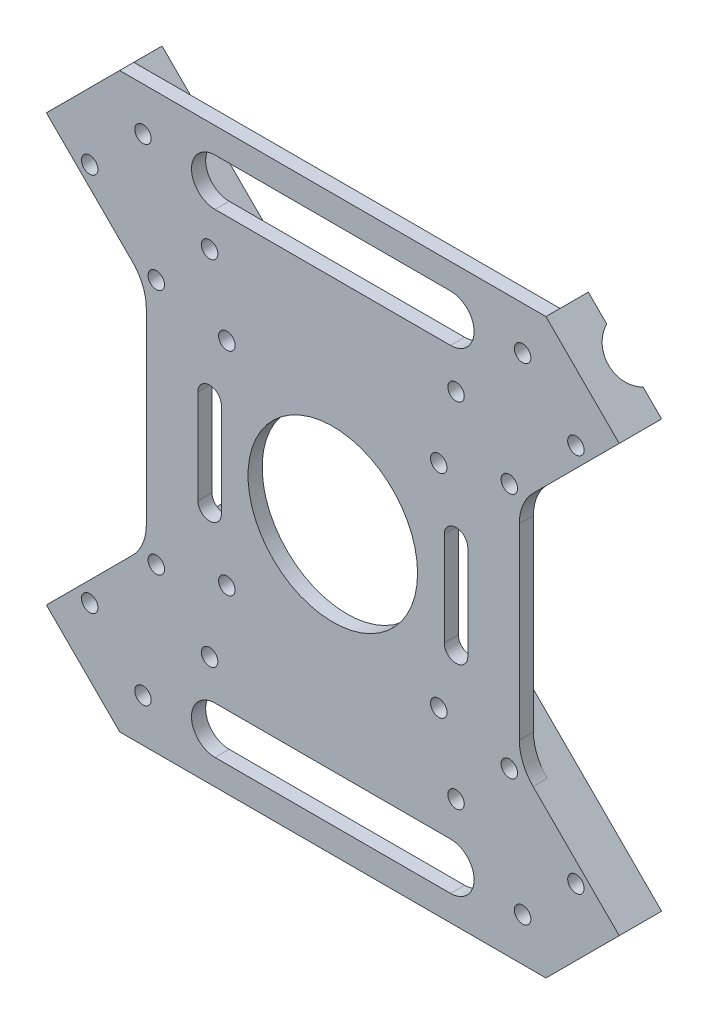
from build123d import *

# Parameters (mm, degrees)
SKETCH1_R           = 18
SKETCH1_R_2         = 1.75
BOSS_EXTRUDE1_DEPTH = 3
BOSS_EXTRUDE3_DEPTH = 6
CUT_EXTRUDE1_REACH  = 163.112
SKETCH4_R           = 6
CUT_EXTRUDE2_REACH  = 163.112
SKETCH5_R           = 6
CUT_EXTRUDE3_START  = -12
SKETCH1_7_R         = 1.75
CUT_EXTRUDE3_DEPTH  = 12
CUT_EXTRUDE4_START  = -12
SKETCH1_8_R         = 1.75
CUT_EXTRUDE4_DEPTH  = 12


with BuildPart() as part:
    # Sketch1 → Boss-Extrude1 (new body)
    with BuildSketch(Plane.XY):
        with BuildLine():
            Line((-45.254833996, 60.811183182), (45.254833996, 60.811183182))
            Line((45.254833996, 60.811183182), (60.811183182, 45.254833996))
            Line((60.811183182, 45.254833996), (42.526911935, 26.970562748))
            ThreePointArc((42.526911935, 26.970562748), (40.359184421, 23.72632926), (39.597979746, 19.899494937))
            Line((39.597979746, 19.899494937), (39.597979746, -19.899494937))
            ThreePointArc((39.597979746, -19.899494937), (40.359184421, -23.72632926), (42.526911935, -26.970562748))
            Line((42.526911935, -26.970562748), (60.811183182, -45.254833996))
            Line((60.811183182, -45.254833996), (45.254833996, -60.811183182))
            Line((45.254833996, -60.811183182), (-45.254833996, -60.811183182))
            Line((-45.254833996, -60.811183182), (-60.811183182, -45.254833996))
            Line((-60.811183182, -45.254833996), (-42.526911935, -26.970562748))
            ThreePointArc((-42.526911935, -26.970562748), (-40.359184421, -23.72632926), (-39.597979746, -19.899494937))
            Line((-39.597979746, -19.899494937), (-39.597979746, 19.899494937))
            ThreePointArc((-39.597979746, 19.899494937), (-40.359184421, 23.72632926), (-42.526911935, 26.970562748))
            Line((-42.526911935, 26.970562748), (-60.811183182, 45.254833996))
            Line((-60.811183182, 45.254833996), (-45.254833996, 60.811183182))
        make_face()
        Circle(SKETCH1_R, mode=Mode.SUBTRACT)
        with Locations((-37.476659403, -26.162950904)):
            Circle(SKETCH1_R_2, mode=Mode.SUBTRACT)
        with Locations((-26.162950904, -37.476659403)):
            Circle(SKETCH1_R_2, mode=Mode.SUBTRACT)
        with Locations((-40.305086528, -51.618795027)):
            Circle(SKETCH1_R_2, mode=Mode.SUBTRACT)
        with Locations((-51.618795027, -40.305086528)):
            Circle(SKETCH1_R_2, mode=Mode.SUBTRACT)
        with Locations((-22.5, 22.5)):
            Circle(SKETCH1_R_2, mode=Mode.SUBTRACT)
        with Locations((22.5, 22.5)):
            Circle(SKETCH1_R_2, mode=Mode.SUBTRACT)
        with Locations((26.162950904, 37.476659403)):
            Circle(SKETCH1_R_2, mode=Mode.SUBTRACT)
        with Locations((37.476659403, 26.162950904)):
            Circle(SKETCH1_R_2, mode=Mode.SUBTRACT)
        with Locations((51.618795027, 40.305086528)):
            Circle(SKETCH1_R_2, mode=Mode.SUBTRACT)
        with Locations((40.305086528, 51.618795027)):
            Circle(SKETCH1_R_2, mode=Mode.SUBTRACT)
        with Locations((22.5, -22.5)):
            Circle(SKETCH1_R_2, mode=Mode.SUBTRACT)
        with Locations((40.305086528, -51.618795027)):
            Circle(SKETCH1_R_2, mode=Mode.SUBTRACT)
        with Locations((51.618795027, -40.305086528)):
            Circle(SKETCH1_R_2, mode=Mode.SUBTRACT)
        with Locations((37.476659403, -26.162950904)):
            Circle(SKETCH1_R_2, mode=Mode.SUBTRACT)
        with Locations((26.162950904, -37.476659403)):
            Circle(SKETCH1_R_2, mode=Mode.SUBTRACT)
        with Locations((-22.5, -22.5)):
            Circle(SKETCH1_R_2, mode=Mode.SUBTRACT)
        with Locations((-51.618795027, 40.305086528)):
            Circle(SKETCH1_R_2, mode=Mode.SUBTRACT)
        with Locations((-40.305086528, 51.618795027)):
            Circle(SKETCH1_R_2, mode=Mode.SUBTRACT)
        with Locations((-26.162950904, 37.476659403)):
            Circle(SKETCH1_R_2, mode=Mode.SUBTRACT)
        with Locations((-37.476659403, 26.162950904)):
            Circle(SKETCH1_R_2, mode=Mode.SUBTRACT)
        with BuildLine():
            Line((-25, -55.386039841), (25, -55.386039841))
            ThreePointArc((25, -55.386039841), (30, -50.386039841), (25, -45.386039841))
            Line((25, -45.386039841), (-25, -45.386039841))
            ThreePointArc((-25, -45.386039841), (-30, -50.386039841), (-25, -55.386039841))
        make_face(mode=Mode.SUBTRACT)
        with BuildLine():
            Line((23.662950904, -10), (23.662950904, 10))
            ThreePointArc((23.662950904, 10), (26.162950904, 12.5), (28.662950904, 10))
            Line((28.662950904, 10), (28.662950904, -10))
            ThreePointArc((28.662950904, -10), (26.162950904, -12.5), (23.662950904, -10))
        make_face(mode=Mode.SUBTRACT)
        with BuildLine():
            Line((-28.662950904, -10), (-28.662950904, 10))
            ThreePointArc((-28.662950904, 10), (-26.162950904, 12.5), (-23.662950904, 10))
            Line((-23.662950904, 10), (-23.662950904, -10))
            ThreePointArc((-23.662950904, -10), (-26.162950904, -12.5), (-28.662950904, -10))
        make_face(mode=Mode.SUBTRACT)
        with BuildLine():
            Line((-25, 45.386039841), (25, 45.386039841))
            ThreePointArc((25, 45.386039841), (30, 50.386039841), (25, 55.386039841))
            Line((25, 55.386039841), (-25, 55.386039841))
            ThreePointArc((-25, 55.386039841), (-30, 50.386039841), (-25, 45.386039841))
        make_face(mode=Mode.SUBTRACT)
    extrude(amount=BOSS_EXTRUDE1_DEPTH)

    # Sketch3 → Boss-Extrude3 (add)
    with BuildSketch(Plane.XY):
        Polygon((-60.811183182, 45.254833996), (-45.254833996, 60.811183182), (-17.053249746, 32.609598932), (-32.609598932, 17.053249746), align=None)
        Polygon((-60.811183182, -45.254833996), (-32.609598932, -17.053249746), (-17.053249746, -32.609598932), (-45.254833996, -60.811183182), align=None)
        Polygon((60.811183182, -45.254833996), (45.254833996, -60.811183182), (17.053249746, -32.609598932), (32.609598932, -17.053249746), align=None)
        Polygon((60.811183182, 45.254833996), (32.609598932, 17.053249746), (17.053249746, 32.609598932), (45.254833996, 60.811183182), align=None)
    extrude(amount=-BOSS_EXTRUDE3_DEPTH)

    # Cut-Extrude1: up to this face of the body (flat: up to its plane)
    cut_extrude1_end = Plane(part.part.faces().sort_by_distance((53.033008589, -53.033008589, -1.5))[0])
    # Sketch4 → Cut-Extrude1 (cut, up to the picked face)
    with BuildSketch(Plane(origin=(-53.033008589, 53.033008589, 0), x_dir=(0, 0, 1), z_dir=(-0.7071067811865477, 0.7071067811865475, 0)), mode=Mode.PRIVATE) as cut_extrude1_sk1:
        with Locations((-8.5, 0)):
            Circle(SKETCH4_R)
    cut_extrude1_tool1 = split(extrude(cut_extrude1_sk1.sketch, amount=-CUT_EXTRUDE1_REACH, mode=Mode.PRIVATE), bisect_by=cut_extrude1_end, keep=Keep.BOTH, mode=Mode.PRIVATE)
    add(cut_extrude1_tool1.solids().sort_by(Axis((-53.033009, 53.033009, -8.5), (0.7071067811865477, -0.7071067811865475, 0)))[0], mode=Mode.SUBTRACT)

    # Cut-Extrude2: up to this face of the body (flat: up to its plane)
    cut_extrude2_end = Plane(part.part.faces().sort_by_distance((53.033008589, 53.033008589, -1.5))[0])
    # Sketch5 → Cut-Extrude2 (cut, up to the picked face)
    with BuildSketch(Plane(origin=(-53.033008589, -53.033008589, 0), x_dir=(0, 0, 1), z_dir=(-0.7071067811865477, -0.7071067811865475, 0)), mode=Mode.PRIVATE) as cut_extrude2_sk1:
        with Locations((-8.5, 0)):
            Circle(SKETCH5_R)
    cut_extrude2_tool1 = split(extrude(cut_extrude2_sk1.sketch, amount=-CUT_EXTRUDE2_REACH, mode=Mode.PRIVATE), bisect_by=cut_extrude2_end, keep=Keep.BOTH, mode=Mode.PRIVATE)
    add(cut_extrude2_tool1.solids().sort_by(Axis((-53.033009, -53.033009, -8.5), (0.7071067811865477, 0.7071067811865475, 0)))[0], mode=Mode.SUBTRACT)

    # Sketch1<7> → Cut-Extrude3 (cut)
    with BuildSketch(Plane.XY.offset(CUT_EXTRUDE3_START)):
        with Locations((-37.476659403, -26.162950904)):
            Circle(SKETCH1_7_R)
        with Locations((-26.162950904, -37.476659403)):
            Circle(SKETCH1_7_R)
        with Locations((-40.305086528, -51.618795027)):
            Circle(SKETCH1_7_R)
        with Locations((-51.618795027, -40.305086528)):
            Circle(SKETCH1_7_R)
        with Locations((26.162950904, 37.476659403)):
            Circle(SKETCH1_7_R)
        with Locations((51.618795027, 40.305086528)):
            Circle(SKETCH1_7_R)
        with Locations((40.305086528, 51.618795027)):
            Circle(SKETCH1_7_R)
        with Locations((40.305086528, -51.618795027)):
            Circle(SKETCH1_7_R)
        with Locations((51.618795027, -40.305086528)):
            Circle(SKETCH1_7_R)
        with Locations((37.476659403, -26.162950904)):
            Circle(SKETCH1_7_R)
        with Locations((26.162950904, -37.476659403)):
            Circle(SKETCH1_7_R)
        with Locations((-51.618795027, 40.305086528)):
            Circle(SKETCH1_7_R)
        with Locations((-40.305086528, 51.618795027)):
            Circle(SKETCH1_7_R)
        with Locations((-26.162950904, 37.476659403)):
            Circle(SKETCH1_7_R)
        with Locations((-37.476659403, 26.162950904)):
            Circle(SKETCH1_7_R)
    extrude(amount=CUT_EXTRUDE3_DEPTH, mode=Mode.SUBTRACT)

    # Sketch1<8> → Cut-Extrude4 (cut)
    with BuildSketch(Plane.XY.offset(CUT_EXTRUDE4_START)):
        with Locations((37.476659403, 26.162950904)):
            Circle(SKETCH1_8_R)
    extrude(amount=CUT_EXTRUDE4_DEPTH, mode=Mode.SUBTRACT)


solid = part.part
